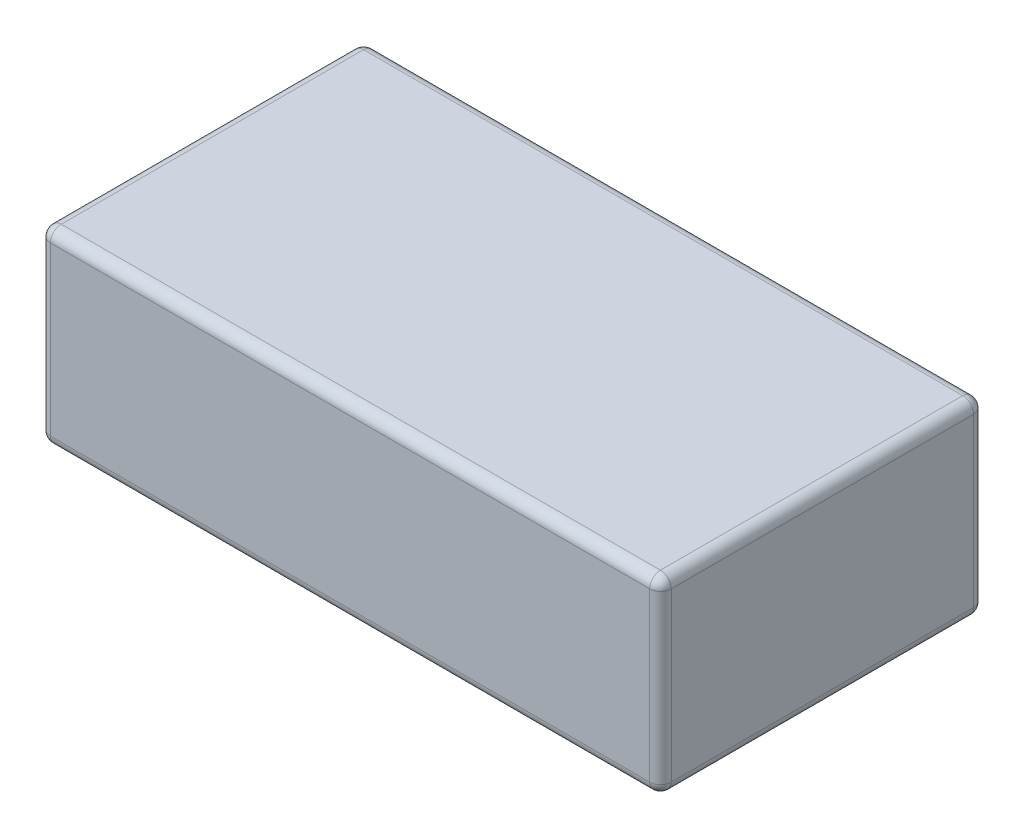
from build123d import *

# Parameters (mm, degrees)
SKETCH1_W           = 115
SKETCH1_H           = 35
BOSS_EXTRUDE1_DEPTH = 60
FILLET1_R           = 2


with BuildPart() as part:
    # Sketch1 → Boss-Extrude1 (new body)
    with BuildSketch(Plane.XY):
        Rectangle(SKETCH1_W, SKETCH1_H)
    extrude(amount=BOSS_EXTRUDE1_DEPTH)

    # Fillet1
    fillet1_edges = [part.edges().sort_by_distance(p)[0] for p in [
        (-57.5, 0, 60),
        (0, -17.5, 60),
        (57.5, 0, 60),
        (0, -17.5, 0),
        (-57.5, 0, 0),
        (0, 17.5, 0),
        (57.5, 0, 0),
        (0, 17.5, 60),
        (57.5, -17.5, 30),
        (-57.5, -17.5, 30),
        (-57.5, 17.5, 30),
        (57.5, 17.5, 30),
    ]]
    fillet(fillet1_edges, radius=FILLET1_R)


solid = part.part
